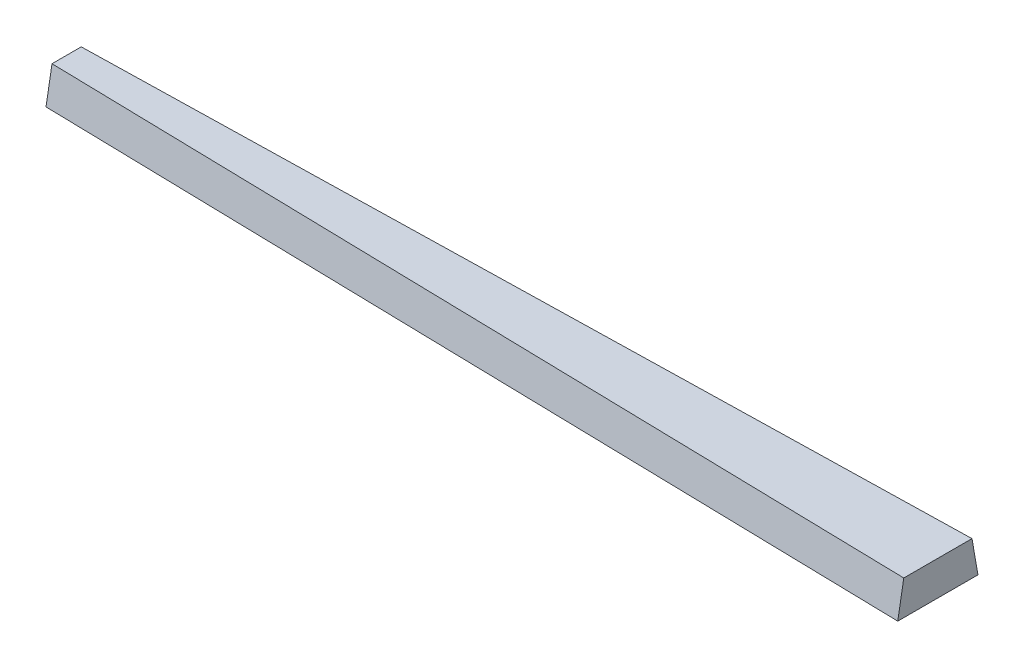
from build123d import *

# Parameters (mm, degrees)
SKETCH1_W           = 482.6
SKETCH1_H           = 50.8
BOSS_EXTRUDE1_DEPTH = 19.05
SKETCH5_W           = 508
SKETCH5_H           = 50.8
CUT_EXTRUDE1_DEPTH  = 246.773661843


with BuildPart() as part:
    # Sketch1 → Boss-Extrude1 (new body)
    with BuildSketch(Plane(origin=(0, 0, 0), x_dir=(1, 0, 0), z_dir=(0, 1, 0))):
        Rectangle(SKETCH1_W, SKETCH1_H)
    extrude(amount=BOSS_EXTRUDE1_DEPTH)

    # Sketch5 → Cut-Extrude1 (cut, through all)
    with BuildSketch(Plane(origin=(-0.36503416, 2.85695762, 16.319174232), x_dir=(0.9997573539412276, 0.0038362476724603106, 0.02169139101649993), z_dir=(-0.0220279772397924, 0.17240303578084593, 0.9847801589554248))):
        with Locations((0, 9.697527332)):
            Rectangle(SKETCH5_W, SKETCH5_H)
    cut_extrude1 = extrude(amount=CUT_EXTRUDE1_DEPTH, mode=Mode.SUBTRACT)

    # Mirror1: Cut-Extrude1 across plane
    add(cut_extrude1.mirror(Plane.XY), mode=Mode.SUBTRACT)


solid = part.part
